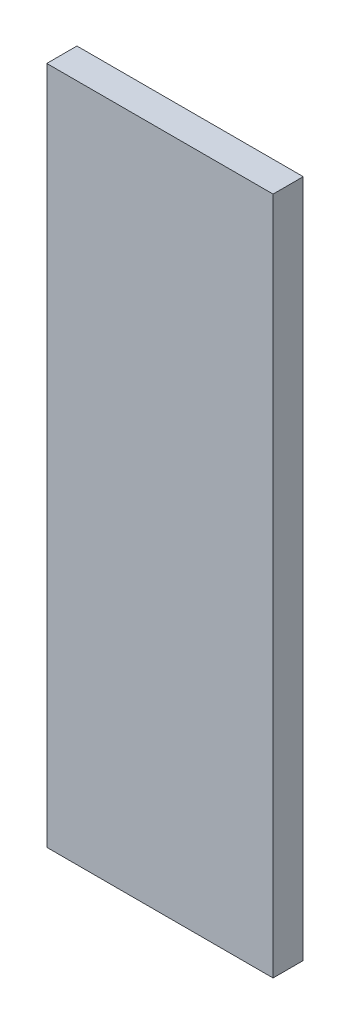
from build123d import *

# Parameters (mm, degrees)
SZKIC1_W                    = 15
SZKIC1_H                    = 45
DODANIE_WYCI_GNI_CIE1_DEPTH = 2


with BuildPart() as part:
    # Szkic1 → Dodanie-wyciągnięcie1 (new body)
    with BuildSketch(Plane.XY):
        with Locations((7.5, 22.5)):
            Rectangle(SZKIC1_W, SZKIC1_H)
    extrude(amount=DODANIE_WYCI_GNI_CIE1_DEPTH)


solid = part.part
